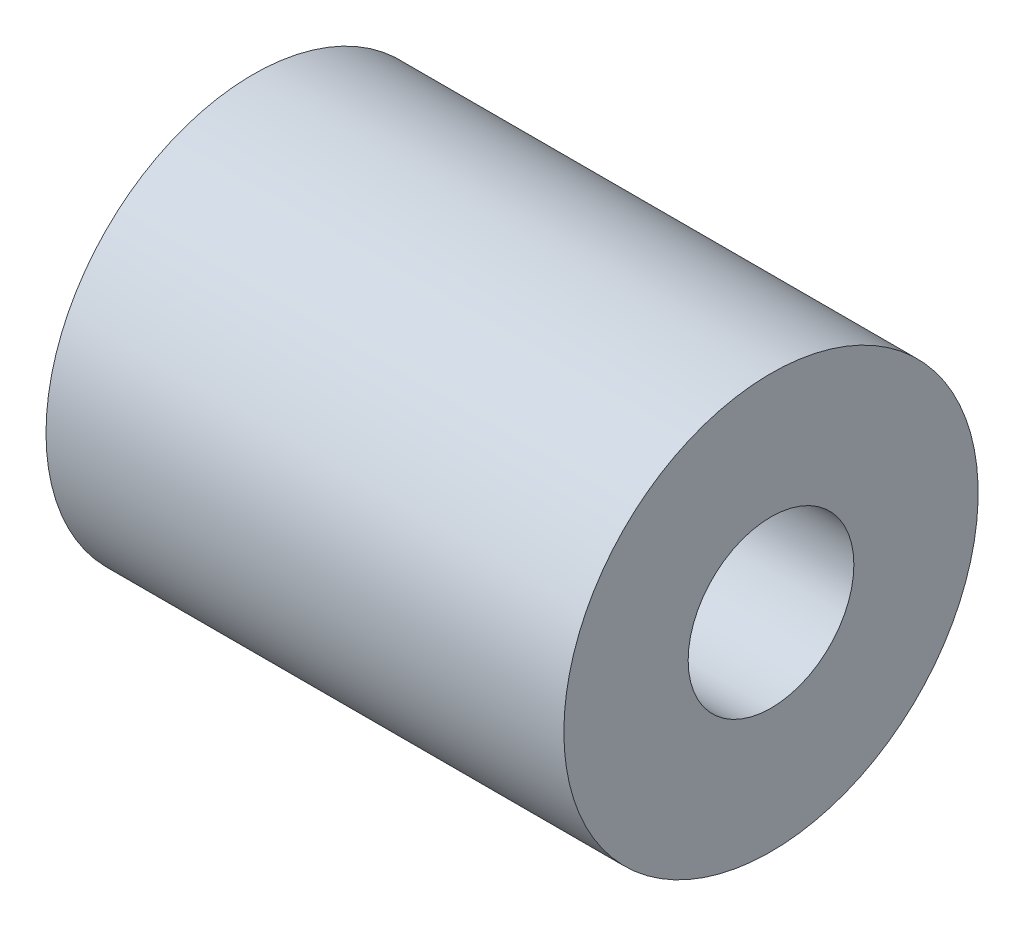
from build123d import *

# Parameters (mm, degrees)
SKETCH_1_W          = 25
SKETCH_1_H          = 10
SKETCH_2_R          = 4
CUT_EXTRUDE_1_DEPTH = 8.5


with BuildPart() as part:
    # 草图1 → 旋转1 (revolve)
    with BuildSketch(Plane.XY, mode=Mode.PRIVATE) as revolve_1_sk:
        with Locations((0, 5)):
            Rectangle(SKETCH_1_W, SKETCH_1_H)
    revolve(revolve_1_sk.sketch.rotate(Axis((-12.5, 0, 0), (1, 0, 0)), 90), axis=Axis((-12.5, 0, 0), (1, 0, 0)))

    # 草图2 → 切除-拉伸1 (cut)
    with BuildSketch(Plane(origin=(12.5, 0, 0), x_dir=(0, 0, -1), z_dir=(1, 0, 0))):
        Circle(SKETCH_2_R)
    cut_extrude_1 = extrude(amount=-CUT_EXTRUDE_1_DEPTH, mode=Mode.SUBTRACT)

    # 镜向1: 切除-拉伸1 across plane
    add(cut_extrude_1.mirror(Plane(origin=(0, 0, 0), x_dir=(0, 0, 1), z_dir=(1, 0, 0))), mode=Mode.SUBTRACT)


solid = part.part
